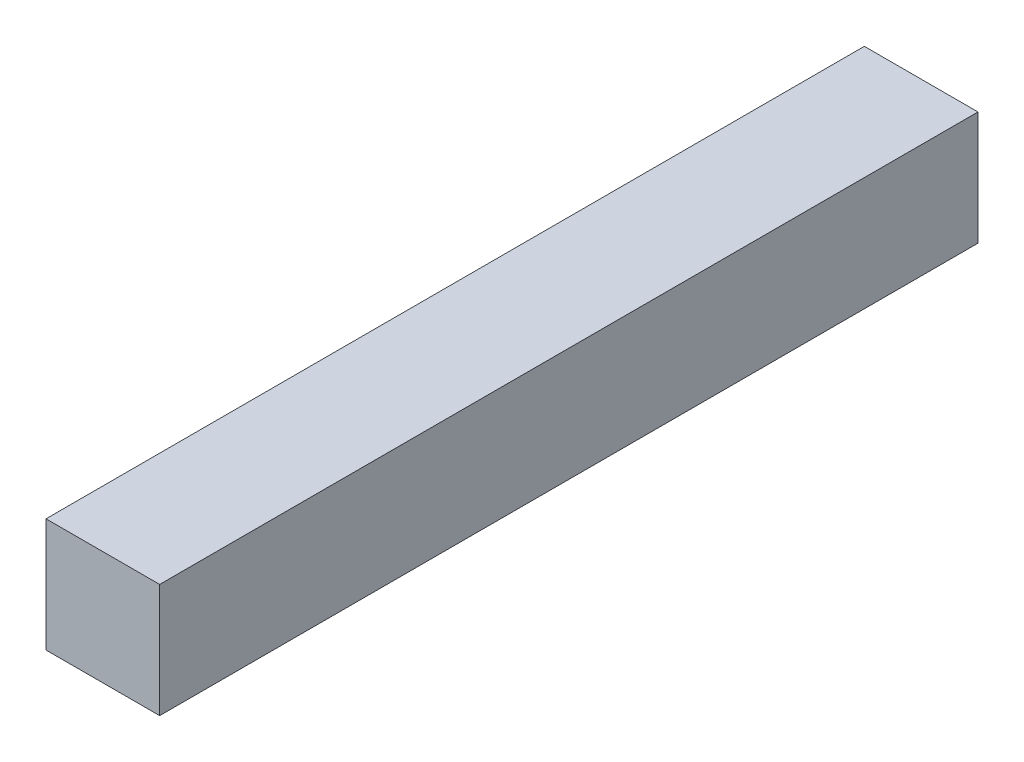
from build123d import *

# Parameters (mm, degrees)
SKETCH1_W           = 5
SKETCH1_H           = 5
BOSS_EXTRUDE1_DEPTH = 36


with BuildPart() as part:
    # Sketch1 → Boss-Extrude1 (new body)
    with BuildSketch(Plane.XY):
        Rectangle(SKETCH1_W, SKETCH1_H)
    extrude(amount=BOSS_EXTRUDE1_DEPTH)


solid = part.part
